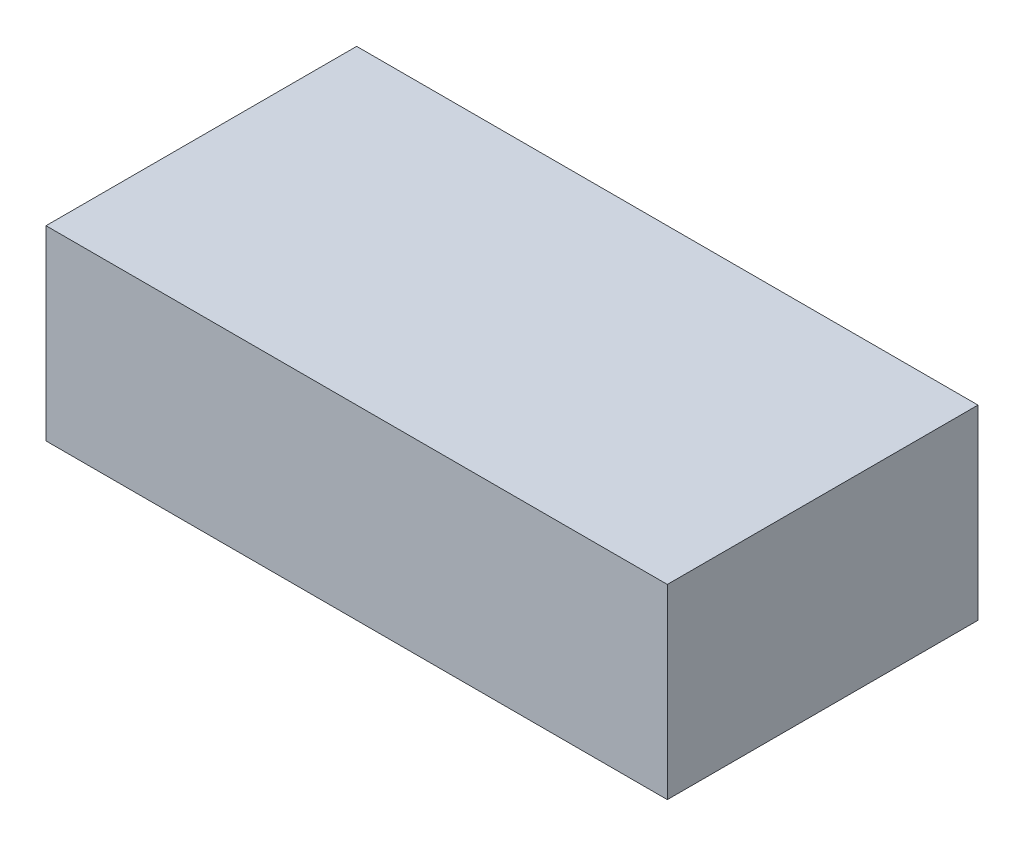
from build123d import *

# Parameters (mm, degrees)
SKETCH2_W           = 20
SKETCH2_H           = 6
BOSS_EXTRUDE1_DEPTH = 10


with BuildPart() as part:
    # Sketch2 → Boss-Extrude1 (new body)
    with BuildSketch(Plane.XY):
        Rectangle(SKETCH2_W, SKETCH2_H)
    extrude(amount=BOSS_EXTRUDE1_DEPTH)


solid = part.part
